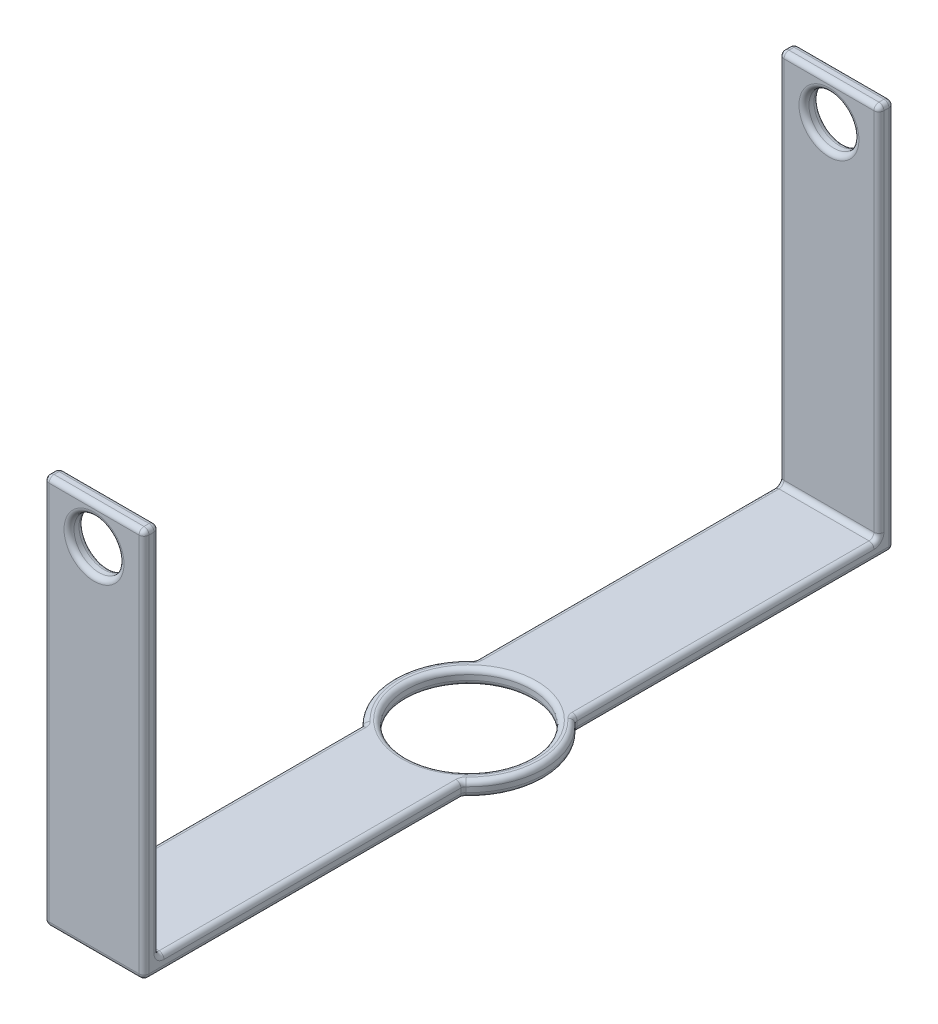
from build123d import *

# Parameters (mm, degrees)
SKETCH1_W           = 20
SKETCH1_H           = 150
BOSS_EXTRUDE1_DEPTH = 3
SKETCH2_W           = 20
SKETCH2_H           = 3
BOSS_EXTRUDE2_DEPTH = 75
SKETCH4_R           = 5
CUT_EXTRUDE1_DEPTH  = 181.547921819
SKETCH5_R           = 15
BOSS_EXTRUDE3_DEPTH = 3
SKETCH6_R           = 12.5
CUT_EXTRUDE2_DEPTH  = 147.062384461
FILLET1_R           = 1


with BuildPart() as part:
    # Sketch1 → Boss-Extrude1 (new body)
    with BuildSketch(Plane(origin=(0, 0, 0), x_dir=(1, 0, 0), z_dir=(0, 1, 0))):
        with Locations((-53.352601156, -30.057803468)):
            Rectangle(SKETCH1_W, SKETCH1_H)
    extrude(amount=BOSS_EXTRUDE1_DEPTH)

    # Sketch2 → Boss-Extrude2 (add)
    with BuildSketch(Plane(origin=(0, 3, 0), x_dir=(1, 0, 0), z_dir=(0, 1, 0))):
        with Locations((-53.352601156, 43.442196532)):
            Rectangle(SKETCH2_W, SKETCH2_H)
        with Locations((-53.352601156, -103.557803468)):
            Rectangle(SKETCH2_W, SKETCH2_H)
    extrude(amount=BOSS_EXTRUDE2_DEPTH)

    # Sketch4 → Cut-Extrude1 (cut, through all)
    with BuildSketch(Plane(origin=(0, 0, -44.942196532), x_dir=(-1, 0, 0), z_dir=(0, 0, -1))):
        with Locations((53.352601156, 70.5)):
            Circle(SKETCH4_R)
    extrude(amount=-CUT_EXTRUDE1_DEPTH, mode=Mode.SUBTRACT)

    # Sketch5 → Boss-Extrude3 (add)
    with BuildSketch(Plane(origin=(0, 3, 0), x_dir=(1, 0, 0), z_dir=(0, 1, 0))):
        with Locations((-53.352601156, -30.057803468)):
            Circle(SKETCH5_R)
    extrude(amount=-BOSS_EXTRUDE3_DEPTH)

    # Sketch6 → Cut-Extrude2 (cut, through all)
    with BuildSketch(Plane(origin=(0, 3, 0), x_dir=(1, 0, 0), z_dir=(0, 1, 0))):
        with Locations(Location((-53.352601156, -30.057803468, 0), (0, 0, 270))):
            Circle(SKETCH6_R)
    extrude(amount=-CUT_EXTRUDE2_DEPTH, mode=Mode.SUBTRACT)

    # Fillet1
    fillet1_edges = [part.edges().sort_by_distance(p)[0] for p in [
        (-63.352601156, 3, -11.532366476),
        (-43.352601156, 3, 71.647973412),
        (-53.352601156, 3, -41.942196532),
        (-63.352601156, 40.5, -41.942196532),
        (-43.352601156, 40.5, -41.942196532),
        (-63.352601156, 78, -43.442196532),
        (-53.352601156, 78, -41.942196532),
        (-43.352601156, 78, -43.442196532),
        (-53.352601156, 78, -44.942196532),
        (-63.352601156, 40.5, 102.057803468),
        (-53.352601156, 3, 102.057803468),
        (-43.352601156, 40.5, 102.057803468),
        (-63.352601156, 78, 103.557803468),
        (-53.352601156, 78, 105.057803468),
        (-43.352601156, 78, 103.557803468),
        (-53.352601156, 78, 102.057803468),
        (-48.352601156, 70.5, 105.057803468),
        (-48.352601156, 70.5, 102.057803468),
        (-48.352601156, 70.5, -41.942196532),
        (-48.352601156, 70.5, -44.942196532),
        (-63.352601156, 0, 73.147973412),
        (-43.352601156, 0, -13.032366476),
        (-53.352601156, 0, -44.942196532),
        (-63.352601156, 3, 71.647973412),
        (-43.352601156, 3, -11.532366476),
        (-43.352601156, 0, 73.147973412),
        (-68.352601156, 3, 30.057803468),
        (-38.352601156, 3, 30.057803468),
        (-68.352601156, 0, 30.057803468),
        (-63.352601156, 1.5, 18.877463581),
        (-43.352601156, 1.5, 18.877463581),
        (-38.352601156, 0, 30.057803468),
        (-53.352601156, 0, 105.057803468),
        (-63.352601156, 1.5, 41.238143356),
        (-43.352601156, 1.5, 41.238143356),
        (-63.352601156, 0, -13.032366476),
        (-53.352601156, 0, 17.557803468),
        (-53.352601156, 3, 17.557803468),
        (-63.352601156, 39, -44.942196532),
        (-43.352601156, 39, -44.942196532),
        (-43.352601156, 39, 105.057803468),
        (-63.352601156, 39, 105.057803468),
    ]]
    fillet(fillet1_edges, radius=FILLET1_R)


solid = part.part
